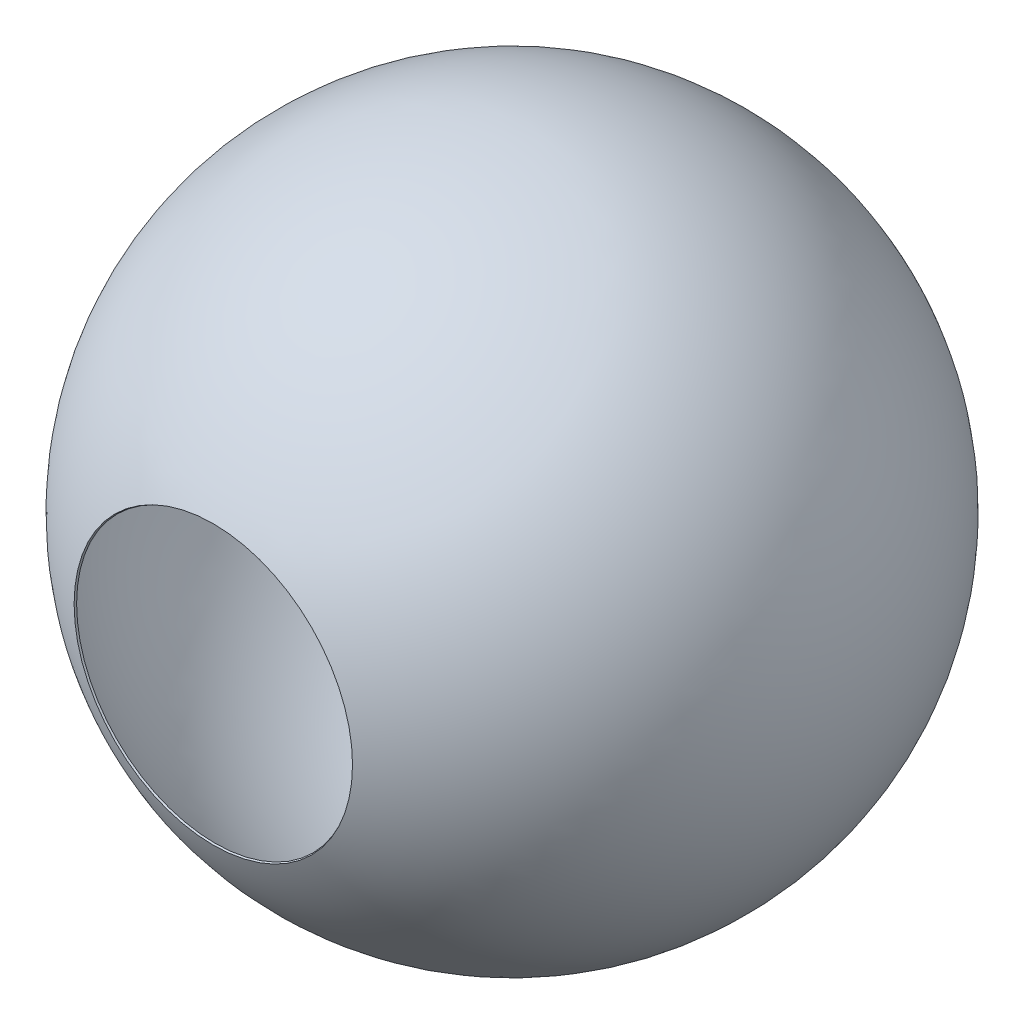
from build123d import *


with BuildPart() as part:
    # Sketch1 → Shell (revolve)
    with BuildSketch(Plane(origin=(0, 0, 0), x_dir=(0, 0, -1), z_dir=(1, 0, 0))):
        with BuildLine():
            Line((528.501551916, 124.639919857), (528.501551916, 0))
            Line((528.501551916, 0), (531.601551916, 0))
            Line((531.601551916, 0), (531.601551916, 125))
            ThreePointArc((531.601551916, 125), (55.906074852, 543.230817236), (-495, 230.651707126))
            Line((-495, 230.651707126), (-492.190075078, 229.342385954))
            ThreePointArc((-492.190075078, 229.342385954), (55.410129392, 540.165453876), (528.501551916, 124.639919857))
        make_face()
    revolve(axis=Axis((0, 0, 495), (0, 0, -1)))


solid = part.part
